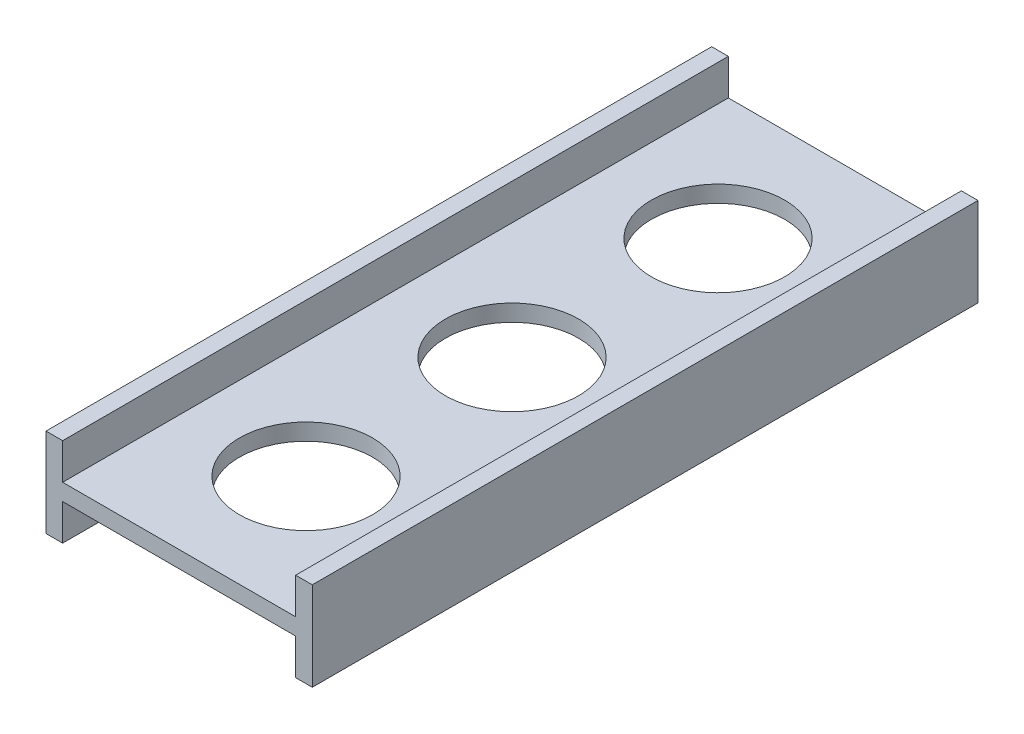
from build123d import *

# Parameters (mm, degrees)
BOSS_EXTRUDE1_DEPTH = 381
SKETCH2_R           = 38.1
CUT_EXTRUDE1_DEPTH  = 889


with BuildPart() as part:
    # Sketch1 → Boss-Extrude1 (new body)
    with BuildSketch(Plane.XY):
        Polygon((0, 0), (9.525, 0), (9.525, 20.6248), (142.875, 20.6248), (142.875, 0), (152.4, 0), (152.4, 50.8), (142.875, 50.8), (142.875, 30.1752), (9.525, 30.1752), (9.525, 50.8), (0, 50.8), align=None)
    extrude(amount=-BOSS_EXTRUDE1_DEPTH)

    # Sketch2 → Cut-Extrude1 (cut)
    with BuildSketch(Plane(origin=(0, 30.1752, 0), x_dir=(-1, 0, 0), z_dir=(0, 1, 0))):
        with Locations((-76.2, -308.408066116)):
            Circle(SKETCH2_R)
        with Locations((-76.2, -190.5)):
            Circle(SKETCH2_R)
        with Locations(Location((-76.2, -72.591933884, 0), (0, 0, 270))):
            Circle(SKETCH2_R)
    extrude(amount=-CUT_EXTRUDE1_DEPTH, mode=Mode.SUBTRACT)


solid = part.part
